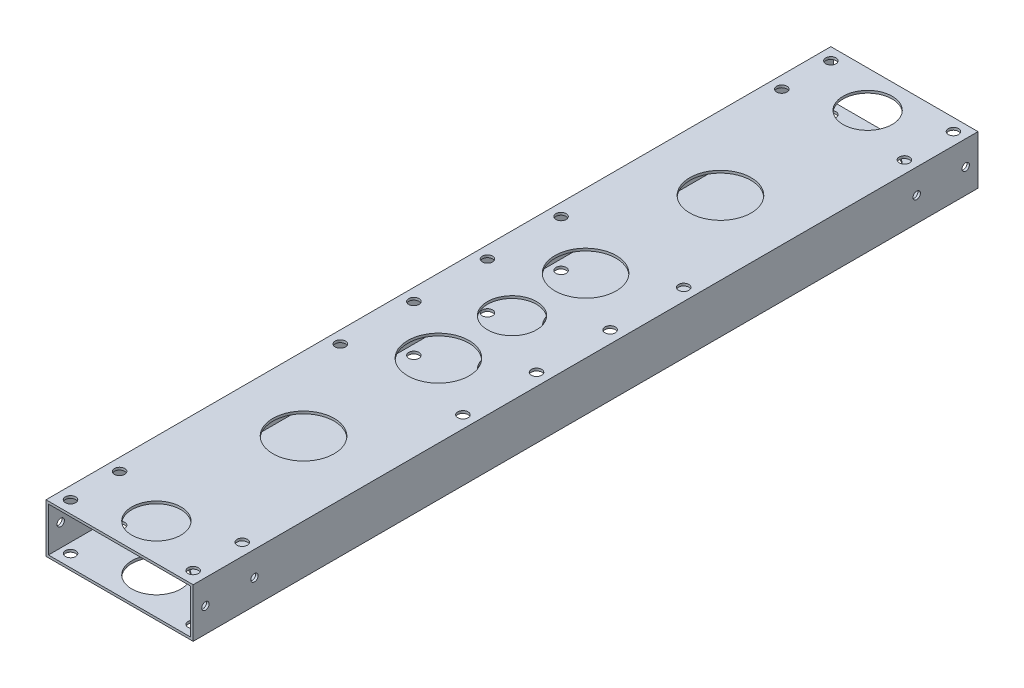
from build123d import *

# Parameters (mm, degrees)
SKETCH_1_W          = 60
SKETCH_1_H          = 20
SKETCH_1_W_2        = 58
SKETCH_1_H_2        = 18
EXTRUDE_1_DEPTH     = 320
SKETCH_2_R          = 2.1
CUT_EXTRUDE_1_DEPTH = 327.190128606
SKETCH_4_R          = 1.5
CUT_EXTRUDE_2_DEPTH = 327.190128606
SKETCH_5_R          = 10
SKETCH_5_R_2        = 12.5
CUT_EXTRUDE_3_DEPTH = 327.190128606


with BuildPart() as part:
    # 草图1 → 拉伸-薄壁1 (new body)
    with BuildSketch(Plane.XY):
        with Locations((30, 10)):
            Rectangle(SKETCH_1_W, SKETCH_1_H)
        with Locations((30, 10)):
            Rectangle(SKETCH_1_W_2, SKETCH_1_H_2, mode=Mode.SUBTRACT)
    extrude(amount=EXTRUDE_1_DEPTH)

    # 草图2 → 切除-拉伸1 (cut, through all)
    with BuildSketch(Plane(origin=(0, 20, 0), x_dir=(1, 0, 0), z_dir=(0, 1, 0))):
        with Locations(Location((5, -145, 0), (0, 0, 270))):
            Circle(SKETCH_2_R)
        with Locations(Location((5, -175, 0), (0, 0, 270))):
            Circle(SKETCH_2_R)
        with Locations(Location((55, -175, 0), (0, 0, 90))):
            Circle(SKETCH_2_R)
        with Locations(Location((55, -145, 0), (0, 0, 90))):
            Circle(SKETCH_2_R)
        with Locations(Location((5, -115, 0), (0, 0, 270))):
            Circle(SKETCH_2_R)
        with Locations(Location((5, -205, 0), (0, 0, 90))):
            Circle(SKETCH_2_R)
        with Locations(Location((55, -205, 0), (0, 0, 270))):
            Circle(SKETCH_2_R)
        with Locations(Location((55, -115, 0), (0, 0, 90))):
            Circle(SKETCH_2_R)
        with Locations(Location((5, -5, 0), (0, 0, 270))):
            Circle(SKETCH_2_R)
        with Locations(Location((55, -5, 0), (0, 0, 270))):
            Circle(SKETCH_2_R)
        with Locations(Location((55, -25, 0), (0, 0, 270))):
            Circle(SKETCH_2_R)
        with Locations(Location((5, -25, 0), (0, 0, 270))):
            Circle(SKETCH_2_R)
        with Locations(Location((5, -295, 0), (0, 0, 90))):
            Circle(SKETCH_2_R)
        with Locations(Location((55, -295, 0), (0, 0, 90))):
            Circle(SKETCH_2_R)
        with Locations(Location((55, -315, 0), (0, 0, 90))):
            Circle(SKETCH_2_R)
        with Locations(Location((5, -315, 0), (0, 0, 90))):
            Circle(SKETCH_2_R)
    extrude(amount=-CUT_EXTRUDE_1_DEPTH, mode=Mode.SUBTRACT)

    # 草图4 → 切除-拉伸2 (cut, through all)
    with BuildSketch(Plane(origin=(60, 0, 0), x_dir=(0, 0, -1), z_dir=(1, 0, 0))):
        with Locations((-315, 10)):
            Circle(SKETCH_4_R)
        with Locations((-295, 10)):
            Circle(SKETCH_4_R)
        with Locations(Location((-25, 10, 0), (0, 0, 180))):
            Circle(SKETCH_4_R)
        with Locations(Location((-5, 10, 0), (0, 0, 180))):
            Circle(SKETCH_4_R)
    extrude(amount=-CUT_EXTRUDE_2_DEPTH, mode=Mode.SUBTRACT)

    # 草图5 → 切除-拉伸3 (cut, through all)
    with BuildSketch(Plane(origin=(0, 20, 0), x_dir=(1, 0, 0), z_dir=(0, 1, 0))):
        with Locations(Location((30, -160, 0), (0, 0, 270))):
            Circle(SKETCH_5_R)
        with Locations(Location((30, -130, 0), (0, 0, 270))):
            Circle(SKETCH_5_R_2)
        with Locations(Location((30, -190, 0), (0, 0, 90))):
            Circle(SKETCH_5_R_2)
        with Locations(Location((30, -75, 0), (0, 0, 270))):
            Circle(SKETCH_5_R_2)
        with Locations(Location((30, -15, 0), (0, 0, 270))):
            Circle(SKETCH_5_R)
        with Locations(Location((30, -305, 0), (0, 0, 90))):
            Circle(SKETCH_5_R)
        with Locations(Location((30, -245, 0), (0, 0, 90))):
            Circle(SKETCH_5_R_2)
    extrude(amount=-CUT_EXTRUDE_3_DEPTH, mode=Mode.SUBTRACT)


solid = part.part
